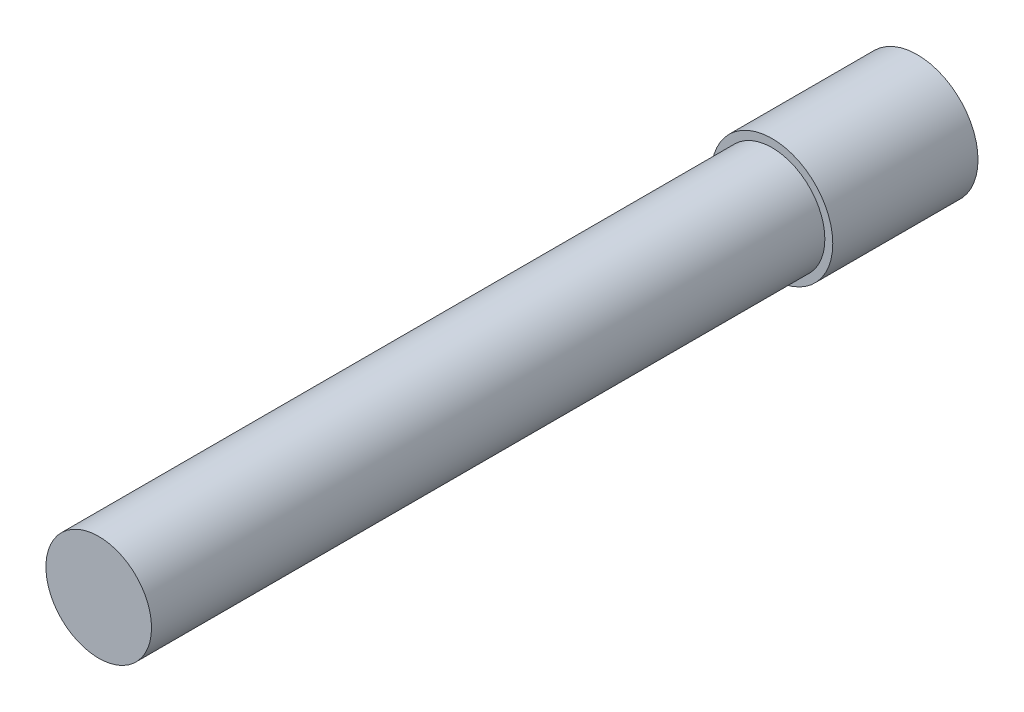
from build123d import *

# Parameters (mm, degrees)
ESBO_O1_R                = 2.3
RESSALTO_EXTRUS_O1_DEPTH = 5.5
ESBO_O2_R                = 2
RESSALTO_EXTRUS_O2_DEPTH = 25.5


with BuildPart() as part:
    # Esboço1 → Ressalto-extrusão1 (new body)
    with BuildSketch(Plane.XY):
        Circle(ESBO_O1_R)
    extrude(amount=RESSALTO_EXTRUS_O1_DEPTH)

    # Esboço2 → Ressalto-extrusão2 (add)
    with BuildSketch(Plane.XY.offset(5.5)):
        Circle(ESBO_O2_R)
    extrude(amount=RESSALTO_EXTRUS_O2_DEPTH)


solid = part.part
